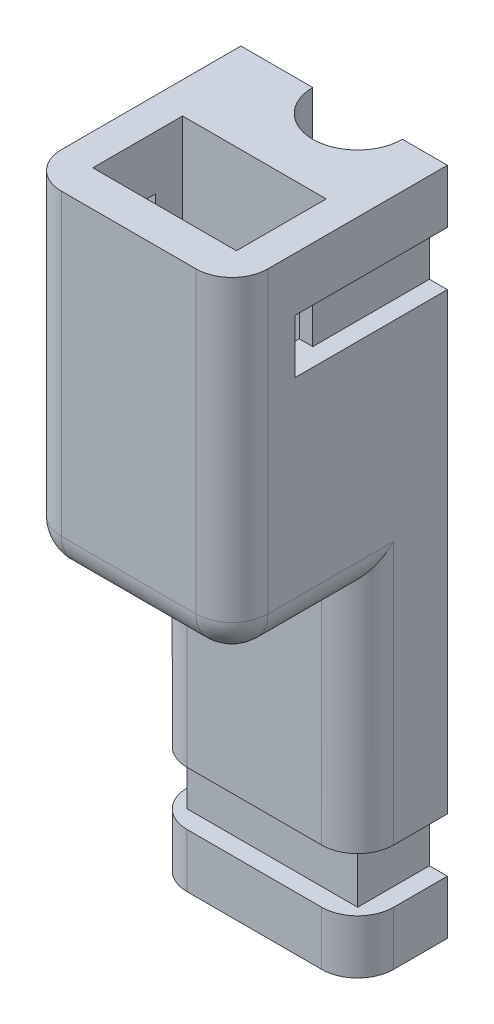
from build123d import *

# Parameters (mm, degrees)
CROQUIS2_W              = 11.5
CROQUIS2_H              = 37.290106074
SALIENTE_EXTRUIR1_DEPTH = 5
CROQUIS6_W              = 11.5
CROQUIS6_H              = 18.645053037
SALIENTE_EXTRUIR2_DEPTH = 7
CROQUIS4_W              = 1
CROQUIS4_H              = 3
CORTAR_EXTRUIR2_DEPTH   = 6.5
CORTAR_EXTRUIR3_START   = -10.5
CROQUIS5_W              = 2
CROQUIS5_H              = 3
CROQUIS5_W_2            = 3.958309594
CORTAR_EXTRUIR3_DEPTH   = 11.5
CROQUIS7_W              = 8
CROQUIS7_H              = 5
CORTAR_EXTRUIR4_DEPTH   = 15
REDONDEO1_R             = 2


with BuildPart() as part:
    # Croquis2 → Saliente-Extruir1 (new body)
    with BuildSketch(Plane.XY):
        with Locations((-0.75, 0)):
            Rectangle(CROQUIS2_W, CROQUIS2_H)
    extrude(amount=SALIENTE_EXTRUIR1_DEPTH)

    # Croquis2<4> → Cortar-Revolución1 (revolve, cut)
    with BuildSketch(Plane.XY):
        Polygon((-2.5, -18.645053037), (0, -18.645053037), (0, 18.645053037), (-2.5, 18.645053037), (-2.5, 9.645053037), (-3.5, 7), (-3.5, -7), (-2.5, -9.645053037), align=None)
    revolve(axis=Axis((0, 7, 0), (0, 1, 0)), mode=Mode.SUBTRACT)

    # Croquis3 → Cortar-Revolución2 (revolve, cut)
    with BuildSketch(Plane(origin=(0, 0, 0), x_dir=(-1, 0, 0), z_dir=(0, 0, -1))):
        Polygon((0, 0), (0, 3.5), (12, 2.5), (12, 0), align=None)
    revolve(axis=Axis((0, 0, 0), (-1, 0, 0)), mode=Mode.SUBTRACT)

    # Croquis6 → Saliente-Extruir2 (add)
    with BuildSketch(Plane.XY.offset(5)):
        with Locations((-0.75, 9.322526519)):
            Rectangle(CROQUIS6_W, CROQUIS6_H)
    extrude(amount=SALIENTE_EXTRUIR2_DEPTH)

    # Croquis4 → Cortar-Extruir2 (cut)
    with BuildSketch(Plane(origin=(0, 0, 0), x_dir=(-1, 0, 0), z_dir=(0, 0, -1))):
        with Locations((-4.5, 14.145053037)):
            Rectangle(CROQUIS4_W, CROQUIS4_H)
        with Locations((6, 14.145053037)):
            Rectangle(CROQUIS4_W, CROQUIS4_H)
        with Locations((6, -14.145053037)):
            Rectangle(CROQUIS4_W, CROQUIS4_H)
        with Locations((-4.5, -14.145053037)):
            Rectangle(CROQUIS4_W, CROQUIS4_H)
    extrude(amount=-CORTAR_EXTRUIR2_DEPTH, mode=Mode.SUBTRACT)

    # Croquis5 → Cortar-Extruir3 (cut)
    with BuildSketch(Plane(origin=(4, 0, 0), x_dir=(0, 0, -1), z_dir=(1, 0, 0)).offset(CORTAR_EXTRUIR3_START)):
        with Locations((-7.5, 14.145053037)):
            Rectangle(CROQUIS5_W, CROQUIS5_H)
        with Locations((-5.979154797, -14.145053037)):
            Rectangle(CROQUIS5_W_2, CROQUIS5_H)
    extrude(amount=CORTAR_EXTRUIR3_DEPTH, mode=Mode.SUBTRACT)

    # Croquis7 → Cortar-Extruir4 (cut)
    with BuildSketch(Plane(origin=(0, 18.645053037, 0), x_dir=(1, 0, 0), z_dir=(0, 1, 0))):
        with Locations((-0.75, -7.5)):
            Rectangle(CROQUIS7_W, CROQUIS7_H)
    extrude(amount=-CORTAR_EXTRUIR4_DEPTH, mode=Mode.SUBTRACT)

    # Redondeo1
    redondeo1_edges = [part.edges().sort_by_distance(p)[0] for p in [
        (-6.5, -6.322526519, 5),
        (5, -6.322526519, 5),
        (5, 0, 8.5),
        (-6.5, 0, 8.5),
        (5, 9.322526519, 12),
        (-6.5, 9.322526519, 12),
        (-0.75, 0, 12),
        (5, -17.145053037, 5),
        (-6.5, -17.145053037, 5),
    ]]
    fillet(redondeo1_edges, radius=REDONDEO1_R)


solid = part.part
